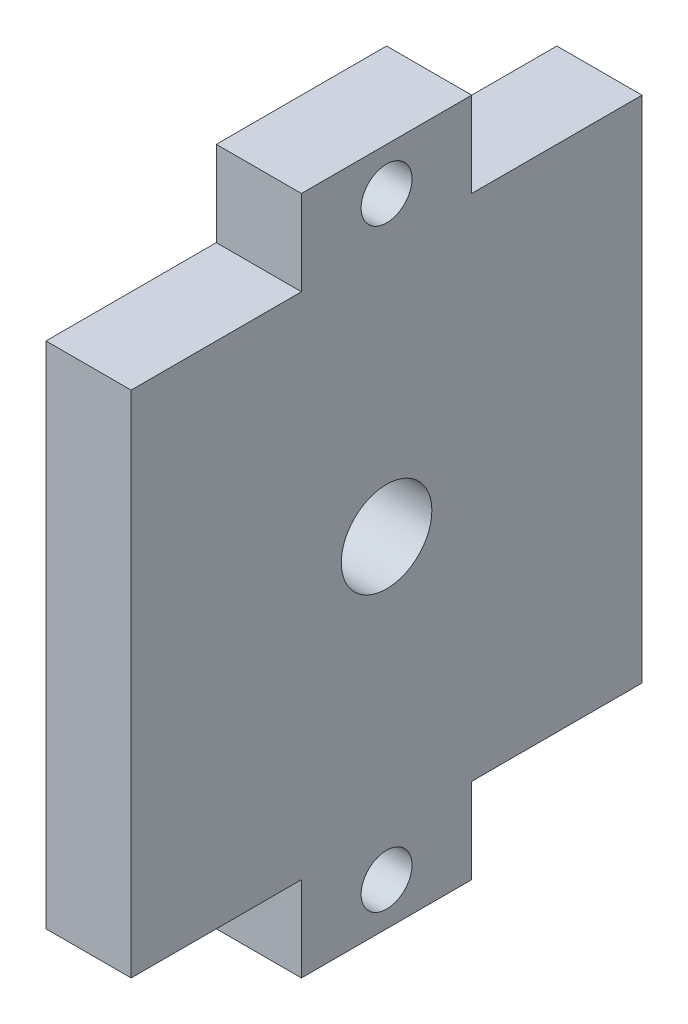
from build123d import *

# Parameters (mm, degrees)
SKETCH1_W               = 38.1
SKETCH1_H               = 50.673
BOSS_EXTRUDE1_DEPTH     = 3.175
CUT_EXTRUDE1_REACH      = 34.329
SKETCH2_W               = 12.7
SKETCH2_H               = 6.35
MIRROR2_COPY_1_REACH    = 34.329
MIRROR2_COPY_1_SKETCH_W = 12.7
MIRROR2_COPY_1_SKETCH_H = 6.35
F_1_4_CLEARANCE_HOLE1_D = 6.7564


with BuildPart() as part:
    # Sketch1 → Boss-Extrude1 (new, symmetric)
    with BuildSketch(Plane(origin=(0, 0, 0), x_dir=(0, 0, -1), z_dir=(1, 0, 0))):
        Rectangle(SKETCH1_W, SKETCH1_H)
    extrude(amount=BOSS_EXTRUDE1_DEPTH, both=True)

    # Sketch2 → Cut-Extrude1 (cut, up to next)
    with BuildSketch(Plane(origin=(3.175, 0, 0), x_dir=(0, 0, -1), z_dir=(1, 0, 0)), mode=Mode.PRIVATE) as cut_extrude1_sk1:
        with Locations((-12.7, 22.1615)):
            Rectangle(SKETCH2_W, SKETCH2_H)
    cut_extrude1_tool1 = extrude(cut_extrude1_sk1.sketch, amount=-CUT_EXTRUDE1_REACH, mode=Mode.PRIVATE) & part.part
    cut_extrude1 = cut_extrude1_tool1.solids().sort_by_distance((3.175, 22.1615, 12.7))[0]
    add(cut_extrude1, mode=Mode.SUBTRACT)

    # Mirror1: Cut-Extrude1 across plane
    add(cut_extrude1.mirror(Plane.XY), mode=Mode.SUBTRACT)

    # Sketch3 → #6 Clearance Hole1 (revolve, cut)
    with BuildSketch(Plane(origin=(3.175, 22.1615, 0), x_dir=(0, 0, -1), z_dir=(0, 1, 0))):
        Polygon((0, 0), (0, 10.030824014), (1.89865, 8.89), (1.89865, 0), align=None)
    f_6_clearance_hole1 = revolve(axis=Axis((9.525, 22.1615, 0), (-1, 0, 0)), mode=Mode.SUBTRACT)

    # Mirror2: Cut-Extrude1, #6 Clearance Hole1 across plane
    add(cut_extrude1.mirror(Plane.ZX), mode=Mode.SUBTRACT)
    add(f_6_clearance_hole1.mirror(Plane.ZX), mode=Mode.SUBTRACT)

    # Mirror2 copy 1 sketch → Mirror2 copy 1 (cut, up to next)
    with BuildSketch(Plane(origin=(3.175, 0, 0), x_dir=(0, 0, 1), z_dir=(1, 0, 0)), mode=Mode.PRIVATE) as mirror2_copy_1_sk1:
        with Locations((-12.7, 22.1615)):
            Rectangle(MIRROR2_COPY_1_SKETCH_W, MIRROR2_COPY_1_SKETCH_H)
    mirror2_copy_1_tool1 = extrude(mirror2_copy_1_sk1.sketch, amount=-MIRROR2_COPY_1_REACH, mode=Mode.PRIVATE) & part.part
    add(mirror2_copy_1_tool1.solids().sort_by_distance((3.175, -22.1615, -12.7))[0], mode=Mode.SUBTRACT)

    # 1/4 Clearance Hole1 (through all)
    with Locations(Plane(origin=(3.175, 0, 0), x_dir=(0, 0, -1), z_dir=(1, 0, 0))):
        with Locations((0, 0)):
            Hole(F_1_4_CLEARANCE_HOLE1_D / 2)


solid = part.part
